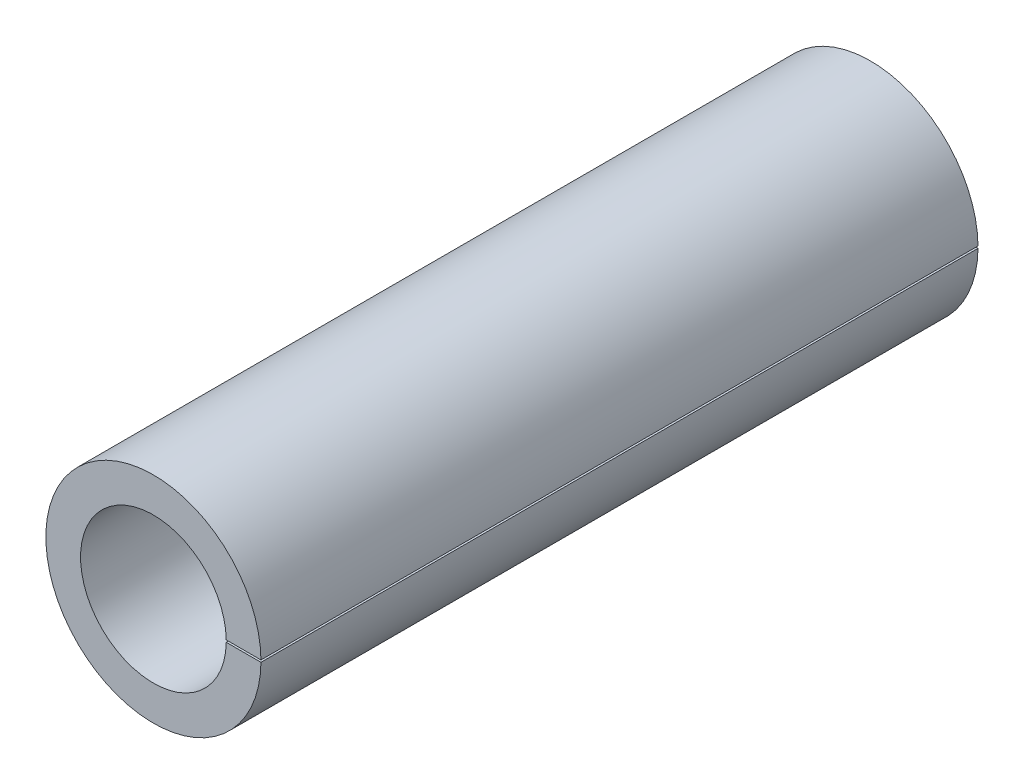
from build123d import *

# Parameters (mm, degrees)
BOSS_EXTRUDE1_DEPTH      = 15.875
BOSS_EXTRUDE1_DEPTH_BACK = 15.875


with BuildPart() as part:
    # Sketch3 → Boss-Extrude1 (new, two sides: drawn at the far end of the back side and taken through both)
    with BuildSketch(Plane.XY.offset(-BOSS_EXTRUDE1_DEPTH_BACK)):
        with BuildLine():
            Line((3.225486109, 0.045), (4.762287397, 0.045))
            ThreePointArc((4.762287397, 0.045), (-4.7625, 0), (4.762287397, -0.045))
            Line((4.762287397, -0.045), (3.225486109, -0.045))
            ThreePointArc((3.225486109, -0.045), (-3.2258, 0), (3.225486109, 0.045))
        make_face()
    extrude(amount=BOSS_EXTRUDE1_DEPTH + BOSS_EXTRUDE1_DEPTH_BACK)


solid = part.part
